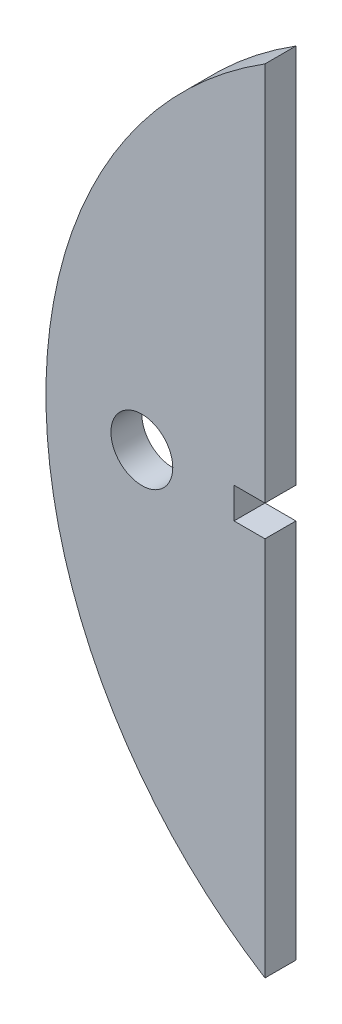
from build123d import *

# Parameters (mm, degrees)
SKETCH1_R           = 3.175
BOSS_EXTRUDE1_DEPTH = 3.175


with BuildPart() as part:
    # Sketch1 → Boss-Extrude1 (new body)
    with BuildSketch(Plane.XY):
        with BuildLine():
            Line((-28.6385, 1.5875), (-25.4635, 1.5875))
            Line((-25.4635, 1.5875), (-25.4635, 40.621342592))
            ThreePointArc((-25.4635, 40.621342592), (-47.9425, 0), (-25.4635, -40.621342592))
            Line((-25.4635, -40.621342592), (-25.4635, -1.5875))
            Line((-25.4635, -1.5875), (-28.6385, -1.5875))
            Line((-28.6385, -1.5875), (-28.6385, 1.5875))
        make_face()
        with Locations((-38.1, 0)):
            Circle(SKETCH1_R, mode=Mode.SUBTRACT)
    extrude(amount=BOSS_EXTRUDE1_DEPTH)


solid = part.part
